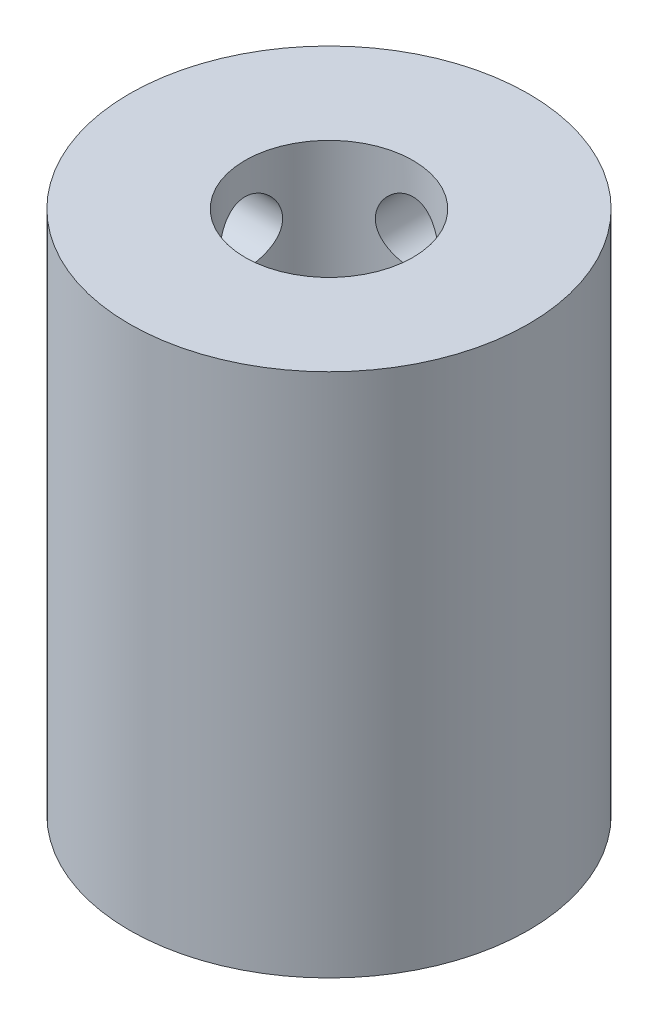
from build123d import *

# Parameters (mm, degrees)
SKETCH_1_R          = 9.5
SKETCH_1_R_2        = 3
EXTRUDE_1_DEPTH     = 25
SKETCH_2_R          = 4
CUT_EXTRUDE_1_DEPTH = 10
SKETCH_3_R          = 1.5
CUT_EXTRUDE_2_DEPTH = 10
SKETCH_4_R          = 1.5
CUT_EXTRUDE_3_DEPTH = 10


with BuildPart() as part:
    # 草图1 → 凸台-拉伸1 (new body)
    with BuildSketch(Plane(origin=(0, 0, 0), x_dir=(1, 0, 0), z_dir=(0, 1, 0))):
        with Locations(Location((0, 0, 0), (0, 0, 270))):
            Circle(SKETCH_1_R)
        with Locations(Location((0, 0, 0), (0, 0, 270))):
            Circle(SKETCH_1_R_2, mode=Mode.SUBTRACT)
    extrude(amount=EXTRUDE_1_DEPTH)

    # 草图2 → 切除-拉伸1 (cut)
    with BuildSketch(Plane(origin=(0, 25, 0), x_dir=(1, 0, 0), z_dir=(0, 1, 0))):
        with Locations(Location((0, 0, 0), (0, 0, 270))):
            Circle(SKETCH_2_R)
    extrude(amount=-CUT_EXTRUDE_1_DEPTH, mode=Mode.SUBTRACT)

    # 草图3 → 切除-拉伸2 (cut)
    with BuildSketch(Plane(origin=(0, 0, 0), x_dir=(0, 0, -1), z_dir=(1, 0, 0))):
        with Locations((0, 3)):
            Circle(SKETCH_3_R)
        with Locations((0, 22)):
            Circle(SKETCH_3_R)
    extrude(amount=-CUT_EXTRUDE_2_DEPTH, mode=Mode.SUBTRACT)

    # 草图4 → 切除-拉伸3 (cut)
    with BuildSketch(Plane.XY):
        with Locations(Location((0, 3, 0), (0, 0, 90))):
            Circle(SKETCH_4_R)
        with Locations((0, 22)):
            Circle(SKETCH_4_R)
    extrude(amount=-CUT_EXTRUDE_3_DEPTH, mode=Mode.SUBTRACT)


solid = part.part
